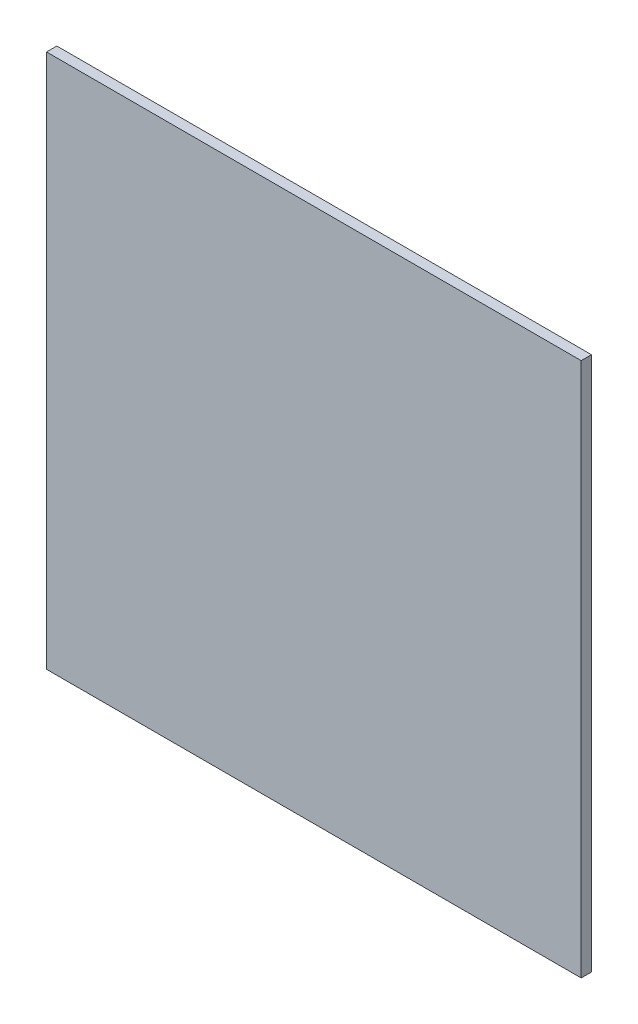
from build123d import *

# Parameters (mm, degrees)
SKETCH1_W           = 520
SKETCH1_H           = 520
BOSS_EXTRUDE1_DEPTH = 10


with BuildPart() as part:
    # Sketch1 → Boss-Extrude1 (new body)
    with BuildSketch(Plane.XY):
        with Locations((260, 260)):
            Rectangle(SKETCH1_W, SKETCH1_H)
    extrude(amount=BOSS_EXTRUDE1_DEPTH)


solid = part.part
